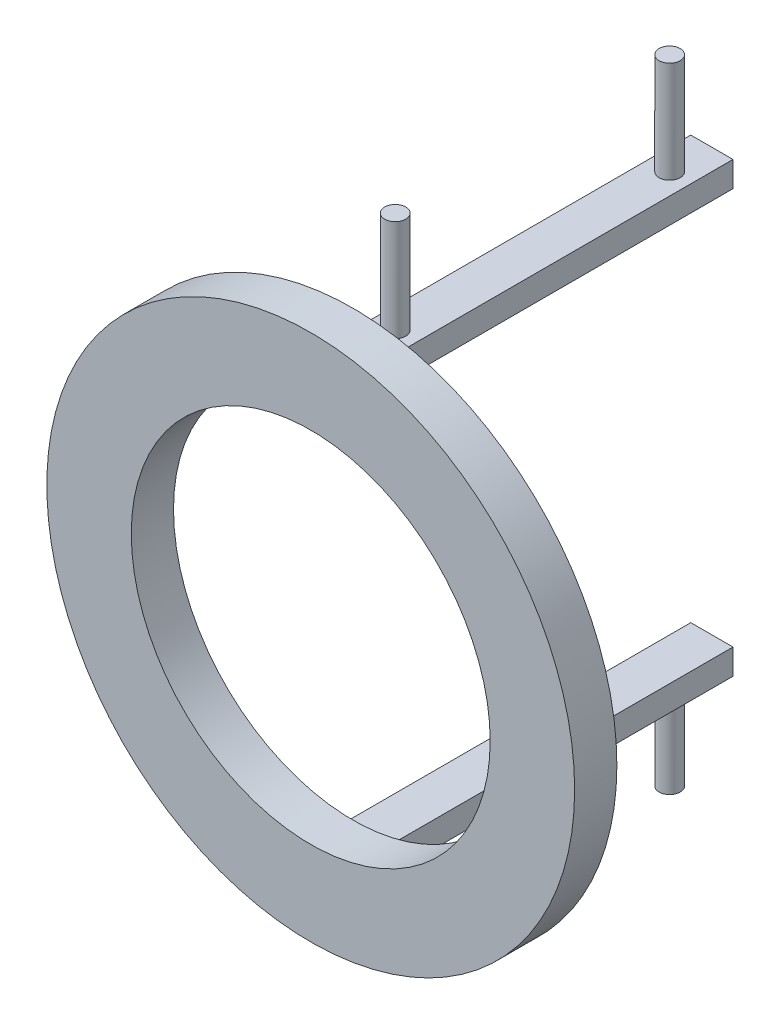
from build123d import *

# Parameters (mm, degrees)
SKETCH1_R           = 12.5
BOSS_EXTRUDE1_DEPTH = 2
SKETCH2_R           = 8.5
CUT_EXTRUDE1_DEPTH  = 2
SKETCH5_W           = 2
SKETCH5_H           = 1.2
BOSS_EXTRUDE3_DEPTH = 17
SKETCH8_R           = 0.5
BOSS_EXTRUDE4_DEPTH = 4.8
BOSS_EXTRUDE5_START = 4
SKETCH9_R           = 0.5
BOSS_EXTRUDE5_DEPTH = 4


with BuildPart() as part:
    # Sketch1 → Boss-Extrude1 (new body)
    with BuildSketch(Plane.XY):
        Circle(SKETCH1_R)
    extrude(amount=BOSS_EXTRUDE1_DEPTH)

    # Sketch2 → Cut-Extrude1 (cut)
    with BuildSketch(Plane.XY.offset(2)):
        Circle(SKETCH2_R)
    extrude(amount=-CUT_EXTRUDE1_DEPTH, mode=Mode.SUBTRACT)

    # Sketch5 → Boss-Extrude3 (add)
    with BuildSketch(Plane(origin=(0, 0, 0), x_dir=(-1, 0, 0), z_dir=(0, 0, -1))):
        with Locations((0, -10)):
            Rectangle(SKETCH5_W, SKETCH5_H)
        with Locations((0, 10)):
            Rectangle(SKETCH5_W, SKETCH5_H)
    extrude(amount=BOSS_EXTRUDE3_DEPTH)

    # Sketch8 → Boss-Extrude4 (add)
    with BuildSketch(Plane(origin=(0, 10.6, 0), x_dir=(1, 0, 0), z_dir=(0, 1, 0))):
        with Locations(Location((0, 2, 0), (0, 0, 90))):
            Circle(SKETCH8_R)
        with Locations(Location((0, 15, 0), (0, 0, 90))):
            Circle(SKETCH8_R)
    extrude(amount=BOSS_EXTRUDE4_DEPTH)

    # Sketch9 → Boss-Extrude5 (add)
    with BuildSketch(Plane.XZ.offset(10.6).offset(BOSS_EXTRUDE5_START)):
        with Locations(Location((0, -2, 0), (0, 0, 270))):
            Circle(SKETCH9_R)
        with Locations(Location((0, -15, 0), (0, 0, 270))):
            Circle(SKETCH9_R)
    extrude(amount=-BOSS_EXTRUDE5_DEPTH)


solid = part.part
